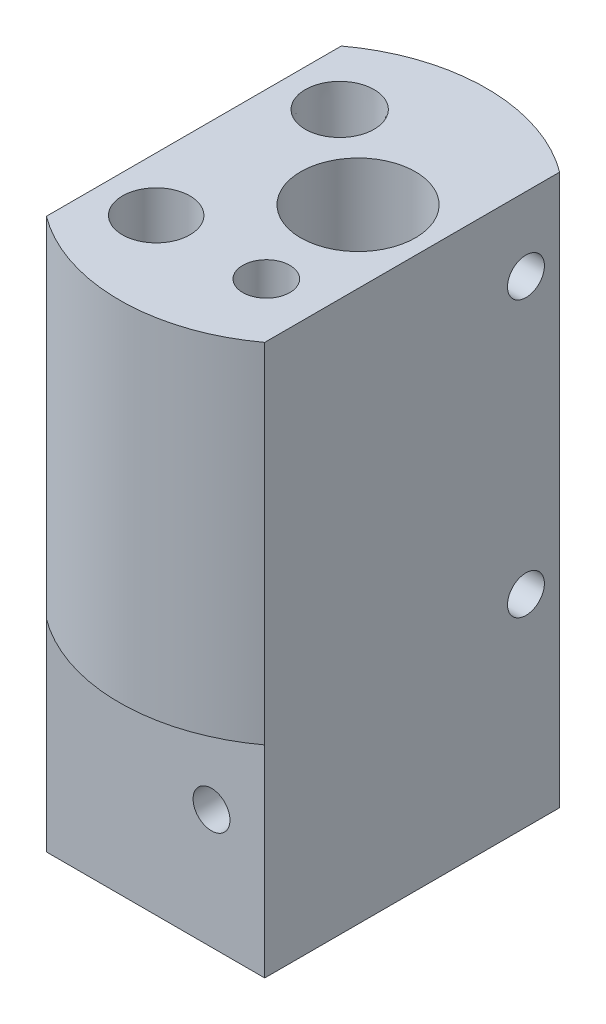
from build123d import *

# Parameters (mm, degrees)
SKETCH2_R                    = 25.4
CYLINDER_BASE_DEPTH          = 76.2
SIDE_START                   = -76.2
SIDE_TRIM_DEPTH              = 76.2
MAIN_HOLE_DEPTH              = 63.5
F_7_16_14_TAPPED_HOLE1_D     = 9.3472
F_7_16_14_TAPPED_HOLE1_DEPTH = 19.543817811
F_7_16_14_TAPPED_HOLE1_TIP   = 2.808182189
F_5_16_18_TAPPED_HOLE1_D     = 6.5278
F_5_16_18_TAPPED_HOLE1_DEPTH = 8.198851026
F_5_16_18_TAPPED_HOLE1_TIP   = 1.961148974
SKETCH19_R                   = 3.175
CUT_EXTRUDE3_DEPTH           = 63.5
SKETCH20_R                   = 4.2164
CUT_EXTRUDE4_DEPTH           = 45.72
SKETCH21_R                   = 3.175
CUT_EXTRUDE5_DEPTH           = 63.5
CUT_EXTRUDE6_START           = -45.72
SKETCH22_R                   = 4.6736
CUT_EXTRUDE6_DEPTH           = 45.72
SKETCH23_R                   = 3.175
CUT_EXTRUDE7_DEPTH           = 63.5
CUT_EXTRUDE9_START           = -14.478
SKETCH25_R                   = 3.2639
CUT_EXTRUDE9_DEPTH           = 14.478
F_1_4_20_TAPPED_HOLE2_D      = 5.1054
F_1_4_20_TAPPED_HOLE2_DEPTH  = 11.166183098
F_1_4_20_TAPPED_HOLE2_TIP    = 1.533816902
CUT_EXTRUDE11_START          = -25.4
SKETCH31_R                   = 2.5527
CUT_EXTRUDE11_DEPTH          = 25.4
F_1_4_20_TAPPED_HOLE3_D      = 5.1054
F_1_4_20_TAPPED_HOLE3_DEPTH  = 14.976183098
F_1_4_20_TAPPED_HOLE3_TIP    = 1.533816902
CUT_EXTRUDE12_START          = -25.4
SKETCH34_R                   = 2.5527
CUT_EXTRUDE12_DEPTH          = 25.4
SKETCH35_R                   = 2.5527
CUT_EXTRUDE13_DEPTH          = 12.7
CUT_EXTRUDE14_DEPTH          = 27.94
F_1_4_20_TAPPED_HOLE4_D      = 5.1054
F_1_4_20_TAPPED_HOLE4_DEPTH  = 9.896183098
F_1_4_20_TAPPED_HOLE4_TIP    = 1.533816902
CUT_EXTRUDE15_START          = -25.4
SKETCH40_R                   = 2.5527
CUT_EXTRUDE15_DEPTH          = 25.4
F_1_4_20_TAPPED_HOLE5_D      = 5.1054
F_1_4_20_TAPPED_HOLE5_DEPTH  = 8.626183098
F_1_4_20_TAPPED_HOLE5_TIP    = 1.533816902
CUT_EXTRUDE16_START          = -13.462
SKETCH43_R                   = 2.5527
CUT_EXTRUDE16_DEPTH          = 13.462
F_1_4_20_TAPPED_HOLE6_D      = 5.1054
F_1_4_20_TAPPED_HOLE6_DEPTH  = 8.626183098
F_1_4_20_TAPPED_HOLE6_TIP    = 1.533816902
CUT_EXTRUDE17_START          = -13.462
SKETCH46_R                   = 2.5527
CUT_EXTRUDE17_DEPTH          = 13.462


with BuildPart() as part:
    # Sketch2 → Cylinder Base (new body)
    with BuildSketch(Plane(origin=(0, 0, 0), x_dir=(1, 0, 0), z_dir=(0, 1, 0))):
        with Locations(Location((0, 0, 0), (0, 0, 90))):
            Circle(SKETCH2_R)
    extrude(amount=CYLINDER_BASE_DEPTH)

    # Sketch3 → Side Trim (cut)
    with BuildSketch(Plane(origin=(0, 76.2, 0), x_dir=(1, 0, 0), z_dir=(0, 1, 0)).offset(SIDE_START)):
        with BuildLine():
            Line((-15.114374034, 20.413615495), (-15.114374034, -20.413615495))
            ThreePointArc((-15.114374034, -20.413615495), (-25.4, 0), (-15.114374034, 20.413615495))
        make_face()
        with BuildLine():
            Line((15.114374034, 20.413615495), (15.114374034, -20.413615495))
            ThreePointArc((15.114374034, -20.413615495), (25.4, 0), (15.114374034, 20.413615495))
        make_face()
    extrude(amount=SIDE_TRIM_DEPTH, mode=Mode.SUBTRACT)

    # Sketch4 → Main Hole (cut)
    with BuildSketch(Plane(origin=(0, 76.2, 0), x_dir=(1, 0, 0), z_dir=(0, 1, 0))):
        with BuildLine():
            ThreePointArc((0, 8.638975836), (-2.558636944, 4.697575464), (-2.440126744, 0))
            Line((-2.440126744, 0), (0, 0))
            Line((0, 0), (0, 8.638975836))
        make_face()
        with BuildLine():
            Line((0, 0), (-2.440126744, 0))
            ThreePointArc((-2.440126744, 0), (-1.466554494, -1.948488666), (0, -3.558975836))
            Line((0, -3.558975836), (0, 0))
        make_face()
        with BuildLine():
            Line((0, 8.638975836), (0, 0))
            Line((0, 0), (12.600126744, 0))
            ThreePointArc((12.600126744, 0), (12.912461691, 1.25296849), (13.0175, 2.54))
            ThreePointArc((13.0175, 2.54), (8.447596045, 9.727711953), (0, 8.638975836))
        make_face()
        with BuildLine():
            Line((12.600126744, 0), (0, 0))
            Line((0, 0), (0, -3.558975836))
            ThreePointArc((0, -3.558975836), (7.237575464, -5.098636944), (12.600126744, 0))
        make_face()
    extrude(amount=-MAIN_HOLE_DEPTH, mode=Mode.SUBTRACT)

    # Sketch14 → 1/8 NPT Tapped Hole4 (revolve, cut)
    with BuildSketch(Plane(origin=(-7.62, 76.2, -12.7), x_dir=(0, 0, 1), z_dir=(1, 0, 0))):
        Polygon((0, 0), (0, 20.32), (4.2164, 17.786531286), (4.2164, 7.62), (4.537407696, 7.62), (4.7655607, 0), align=None)
    revolve(axis=Axis((-7.62, 82.55, -12.7), (0, -1, 0)), mode=Mode.SUBTRACT)

    # 7/16-14 Tapped Hole1
    with Locations(Plane(origin=(-7.62, 76.2, 12.7), x_dir=(0, 0, 1), z_dir=(0, 1, 0))):
        with Locations((0, 0)):
            Hole(F_7_16_14_TAPPED_HOLE1_D / 2, depth=F_7_16_14_TAPPED_HOLE1_DEPTH)
            with Locations((0, 0, -(F_7_16_14_TAPPED_HOLE1_DEPTH + F_7_16_14_TAPPED_HOLE1_TIP / 2))):  # 118° drill point
                Cone(0, F_7_16_14_TAPPED_HOLE1_D / 2, F_7_16_14_TAPPED_HOLE1_TIP, mode=Mode.SUBTRACT)

    # 5/16-18 Tapped Hole1
    with Locations(Plane(origin=(7.62, 76.2, 12.7), x_dir=(0, 0, 1), z_dir=(0, 1, 0))):
        with Locations((0, 0)):
            Hole(F_5_16_18_TAPPED_HOLE1_D / 2, depth=F_5_16_18_TAPPED_HOLE1_DEPTH)
            with Locations((0, 0, -(F_5_16_18_TAPPED_HOLE1_DEPTH + F_5_16_18_TAPPED_HOLE1_TIP / 2))):  # 118° drill point
                Cone(0, F_5_16_18_TAPPED_HOLE1_D / 2, F_5_16_18_TAPPED_HOLE1_TIP, mode=Mode.SUBTRACT)

    # Sketch19 → Cut-Extrude3 (cut)
    with BuildSketch(Plane(origin=(0, 76.2, 0), x_dir=(1, 0, 0), z_dir=(0, 1, 0))):
        with Locations(Location((-7.62, 12.7, 0), (0, 0, 270))):
            Circle(SKETCH19_R)
    extrude(amount=-CUT_EXTRUDE3_DEPTH, mode=Mode.SUBTRACT)

    # Sketch20 → Cut-Extrude4 (cut)
    with BuildSketch(Plane(origin=(0, 76.2, 0), x_dir=(1, 0, 0), z_dir=(0, 1, 0))):
        with Locations(Location((-7.62, 12.7, 0), (0, 0, 270))):
            Circle(SKETCH20_R)
    extrude(amount=-CUT_EXTRUDE4_DEPTH, mode=Mode.SUBTRACT)

    # Sketch21 → Cut-Extrude5 (cut)
    with BuildSketch(Plane(origin=(0, 76.2, 0), x_dir=(1, 0, 0), z_dir=(0, 1, 0))):
        with Locations(Location((-7.62, -12.7, 0), (0, 0, 270))):
            Circle(SKETCH21_R)
    extrude(amount=-CUT_EXTRUDE5_DEPTH, mode=Mode.SUBTRACT)

    # Sketch22 → Cut-Extrude6 (cut)
    with BuildSketch(Plane(origin=(0, 76.2, 0), x_dir=(1, 0, 0), z_dir=(0, 1, 0)).offset(CUT_EXTRUDE6_START)):
        with Locations(Location((-7.62, -12.7, 0), (0, 0, 270))):
            Circle(SKETCH22_R)
    extrude(amount=CUT_EXTRUDE6_DEPTH, mode=Mode.SUBTRACT)

    # Sketch23 → Cut-Extrude7 (cut)
    with BuildSketch(Plane(origin=(0, 76.2, 0), x_dir=(1, 0, 0), z_dir=(0, 1, 0))):
        with Locations(Location((7.62, -12.7, 0), (0, 0, 270))):
            Circle(SKETCH23_R)
    extrude(amount=-CUT_EXTRUDE7_DEPTH, mode=Mode.SUBTRACT)

    # Sketch25 → Cut-Extrude9 (cut)
    with BuildSketch(Plane(origin=(0, 76.2, 0), x_dir=(1, 0, 0), z_dir=(0, 1, 0)).offset(CUT_EXTRUDE9_START)):
        with Locations(Location((7.62, -12.7, 0), (0, 0, 270))):
            Circle(SKETCH25_R)
    extrude(amount=CUT_EXTRUDE9_DEPTH, mode=Mode.SUBTRACT)

    # 1/4-20 Tapped Hole2
    with Locations(Plane(origin=(-15.114374034, 44.45, 12.285615495), x_dir=(0, 0, -1), z_dir=(-1, 0, 0))):
        with Locations((0, 0)):
            Hole(F_1_4_20_TAPPED_HOLE2_D / 2, depth=F_1_4_20_TAPPED_HOLE2_DEPTH)
            with Locations((0, 0, -(F_1_4_20_TAPPED_HOLE2_DEPTH + F_1_4_20_TAPPED_HOLE2_TIP / 2))):  # 118° drill point
                Cone(0, F_1_4_20_TAPPED_HOLE2_D / 2, F_1_4_20_TAPPED_HOLE2_TIP, mode=Mode.SUBTRACT)

    # Sketch31 → Cut-Extrude11 (cut)
    with BuildSketch(Plane.ZY.offset(15.114374034).offset(CUT_EXTRUDE11_START)):
        with Locations((12.285615495, 44.45)):
            Circle(SKETCH31_R)
    extrude(amount=CUT_EXTRUDE11_DEPTH, mode=Mode.SUBTRACT)

    # 1/4-20 Tapped Hole3
    with Locations(Plane(origin=(-15.114374034, 15.24, -10.574384505), x_dir=(0, 0, -1), z_dir=(-1, 0, 0))):
        with Locations((0, 0)):
            Hole(F_1_4_20_TAPPED_HOLE3_D / 2, depth=F_1_4_20_TAPPED_HOLE3_DEPTH)
            with Locations((0, 0, -(F_1_4_20_TAPPED_HOLE3_DEPTH + F_1_4_20_TAPPED_HOLE3_TIP / 2))):  # 118° drill point
                Cone(0, F_1_4_20_TAPPED_HOLE3_D / 2, F_1_4_20_TAPPED_HOLE3_TIP, mode=Mode.SUBTRACT)

    # Sketch34 → Cut-Extrude12 (cut)
    with BuildSketch(Plane.ZY.offset(15.114374034).offset(CUT_EXTRUDE12_START)):
        with Locations((-10.574384505, 15.24)):
            Circle(SKETCH34_R)
    extrude(amount=CUT_EXTRUDE12_DEPTH, mode=Mode.SUBTRACT)

    # Sketch35 → Cut-Extrude13 (cut)
    with BuildSketch(Plane.ZY.offset(15.114374034)):
        with Locations((12.285615495, 15.24)):
            Circle(SKETCH35_R)
    extrude(amount=-CUT_EXTRUDE13_DEPTH, mode=Mode.SUBTRACT)

    # Sketch36 → Cut-Extrude14 (cut)
    with BuildSketch(Plane.XZ):
        with BuildLine():
            Line((-15.114374034, 20.413615495), (15.114374034, 20.413615495))
            ThreePointArc((15.114374034, 20.413615495), (0, 25.4), (-15.114374034, 20.413615495))
        make_face()
    extrude(amount=-CUT_EXTRUDE14_DEPTH, mode=Mode.SUBTRACT)

    # 1/4-20 Tapped Hole4
    with Locations(Plane(origin=(7.748374034, 16.51, 20.413615495), x_dir=(1, 0, 0), z_dir=(0, 0, 1))):
        with Locations((0, 0)):
            Hole(F_1_4_20_TAPPED_HOLE4_D / 2, depth=F_1_4_20_TAPPED_HOLE4_DEPTH)
            with Locations((0, 0, -(F_1_4_20_TAPPED_HOLE4_DEPTH + F_1_4_20_TAPPED_HOLE4_TIP / 2))):  # 118° drill point
                Cone(0, F_1_4_20_TAPPED_HOLE4_D / 2, F_1_4_20_TAPPED_HOLE4_TIP, mode=Mode.SUBTRACT)

    # Sketch40 → Cut-Extrude15 (cut)
    with BuildSketch(Plane.XY.offset(20.413615495).offset(CUT_EXTRUDE15_START)):
        with Locations((7.748374034, 16.51)):
            Circle(SKETCH40_R)
    extrude(amount=CUT_EXTRUDE15_DEPTH, mode=Mode.SUBTRACT)

    # 1/4-20 Tapped Hole5
    with Locations(Plane(origin=(15.114374034, 66.04, -15.748), x_dir=(0, 0, 1), z_dir=(1, 0, 0))):
        with Locations((0, 0)):
            Hole(F_1_4_20_TAPPED_HOLE5_D / 2, depth=F_1_4_20_TAPPED_HOLE5_DEPTH)
            with Locations((0, 0, -(F_1_4_20_TAPPED_HOLE5_DEPTH + F_1_4_20_TAPPED_HOLE5_TIP / 2))):  # 118° drill point
                Cone(0, F_1_4_20_TAPPED_HOLE5_D / 2, F_1_4_20_TAPPED_HOLE5_TIP, mode=Mode.SUBTRACT)

    # Sketch43 → Cut-Extrude16 (cut)
    with BuildSketch(Plane(origin=(15.114374034, 0, 0), x_dir=(0, 0, -1), z_dir=(1, 0, 0)).offset(CUT_EXTRUDE16_START)):
        with Locations((15.748, 66.04)):
            Circle(SKETCH43_R)
    extrude(amount=CUT_EXTRUDE16_DEPTH, mode=Mode.SUBTRACT)

    # 1/4-20 Tapped Hole6
    with Locations(Plane(origin=(15.114374034, 27.94, -15.748), x_dir=(0, 0, 1), z_dir=(1, 0, 0))):
        with Locations((0, 0)):
            Hole(F_1_4_20_TAPPED_HOLE6_D / 2, depth=F_1_4_20_TAPPED_HOLE6_DEPTH)
            with Locations((0, 0, -(F_1_4_20_TAPPED_HOLE6_DEPTH + F_1_4_20_TAPPED_HOLE6_TIP / 2))):  # 118° drill point
                Cone(0, F_1_4_20_TAPPED_HOLE6_D / 2, F_1_4_20_TAPPED_HOLE6_TIP, mode=Mode.SUBTRACT)

    # Sketch46 → Cut-Extrude17 (cut)
    with BuildSketch(Plane(origin=(15.114374034, 0, 0), x_dir=(0, 0, -1), z_dir=(1, 0, 0)).offset(CUT_EXTRUDE17_START)):
        with Locations((15.748, 27.94)):
            Circle(SKETCH46_R)
    extrude(amount=CUT_EXTRUDE17_DEPTH, mode=Mode.SUBTRACT)


solid = part.part
